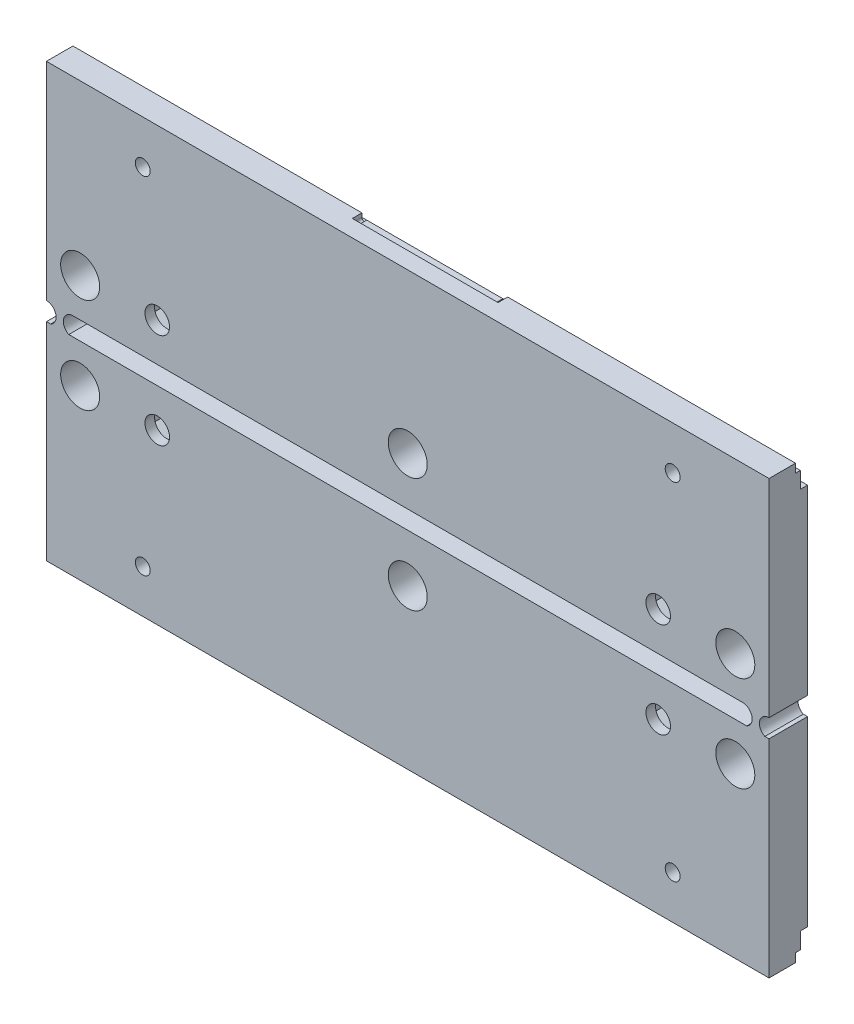
from build123d import *

# Parameters (mm, degrees)
SKETCH_2_W           = 150
SKETCH_2_H           = 43
SKETCH_2_R           = 4.05
EXTRUDE_1_DEPTH      = 8
SKETCH_3_R           = 2.55
CUT_EXTRUDE_1_DEPTH  = 157.246599963
CUT_EXTRUDE_16_DEPTH = 6
CUT_EXTRUDE_2_DEPTH  = 157.246599963
SKETCH_25_R          = 1.55
CUT_EXTRUDE_13_DEPTH = 157.246599963
CUT_EXTRUDE_11_DEPTH = 2
EXTRUDE_2_DEPTH      = 8


with BuildPart() as part:
    # 草图2 → 凸台-拉伸1 (new body)
    with BuildSketch(Plane.XY):
        with Locations((75, 21.5)):
            Rectangle(SKETCH_2_W, SKETCH_2_H)
        with Locations((7, 8)):
            Circle(SKETCH_2_R, mode=Mode.SUBTRACT)
        with Locations((75, 10)):
            Circle(SKETCH_2_R, mode=Mode.SUBTRACT)
        with Locations((143, 8)):
            Circle(SKETCH_2_R, mode=Mode.SUBTRACT)
    extrude_1 = extrude(amount=EXTRUDE_1_DEPTH)

    # 草图3 → 切除-拉伸1 (cut, through all)
    with BuildSketch(Plane.XY.offset(8)):
        with Locations((23, 8)):
            Circle(SKETCH_3_R)
        with Locations((127, 8)):
            Circle(SKETCH_3_R)
    cut_extrude_1 = extrude(amount=-CUT_EXTRUDE_1_DEPTH, mode=Mode.SUBTRACT)

    # 草图28 → 切除-拉伸16 (cut)
    with BuildSketch(Plane(origin=(0, 0, 0), x_dir=(-1, 0, 0), z_dir=(0, 0, -1))):
        Polygon((-122.9, 5.632863896), (-122.9, 10.367136104), (-127, 12.734272207), (-131.1, 10.367136104), (-131.1, 5.632863896), (-127, 3.265727793), align=None)
        Polygon((-18.9, 5.632863896), (-18.9, 10.367136104), (-23, 12.734272207), (-27.1, 10.367136104), (-27.1, 5.632863896), (-23, 3.265727793), align=None)
    cut_extrude_16 = extrude(amount=-CUT_EXTRUDE_16_DEPTH, mode=Mode.SUBTRACT)

    # 草图4 → 切除-拉伸2 (cut, through all)
    with BuildSketch(Plane(origin=(150, 0, 0), x_dir=(0, 0, -1), z_dir=(1, 0, 0))):
        Polygon((-1.5, 41.2), (-2.5, 41.2), (-2.5, 43), (0, 43), (0, 37.8), (-1.5, 37.8), align=None)
    cut_extrude_2 = extrude(amount=-CUT_EXTRUDE_2_DEPTH, mode=Mode.SUBTRACT)

    # 草图25 → 切除-拉伸13 (cut, through all)
    with BuildSketch(Plane(origin=(0, 0, 0), x_dir=(-1, 0, 0), z_dir=(0, 0, -1))):
        with Locations((-130, 34)):
            Circle(SKETCH_25_R)
        with Locations((-20, 34)):
            Circle(SKETCH_25_R)
    cut_extrude_13 = extrude(amount=-CUT_EXTRUDE_13_DEPTH, mode=Mode.SUBTRACT)

    # 草图19 → 切除-拉伸11 (cut)
    with BuildSketch(Plane(origin=(0, 0, 2.5), x_dir=(-1, 0, 0), z_dir=(0, 0, -1))):
        with BuildLine():
            Line((-60, 43), (-90.247938178, 43))
            Line((-90.247938178, 43), (-90.247938178, 42.2))
            ThreePointArc((-90.247938178, 42.2), (-89.747938178, 41.7), (-89.247938178, 42.2))
            Line((-89.247938178, 42.2), (-61, 42.2))
            ThreePointArc((-61, 42.2), (-60.5, 41.7), (-60, 42.2))
            Line((-60, 42.2), (-60, 43))
        make_face()
    cut_extrude_11 = extrude(amount=-CUT_EXTRUDE_11_DEPTH, mode=Mode.SUBTRACT)

    # 草图22 → 凸台-拉伸2 (add)
    with BuildSketch(Plane.XY.offset(8)):
        with BuildLine():
            Line((0, -4), (5.5, -4))
            ThreePointArc((5.5, -4), (3.5, -2), (5.5, 0))
            Line((5.5, 0), (0, 0))
            ThreePointArc((0, 0), (2, -2), (0, -4))
        make_face()
        with BuildLine():
            Line((150, 0), (144.5, 0))
            ThreePointArc((144.5, 0), (146.5, -2), (144.5, -4))
            Line((144.5, -4), (150, -4))
            ThreePointArc((150, -4), (148, -2), (150, 0))
        make_face()
    extrude(amount=-EXTRUDE_2_DEPTH)

    # 镜向2: 凸台-拉伸1, 切除-拉伸1, 切除-拉伸16, 切除-拉伸2, 切除-拉伸13, 切除-拉伸11 across plane
    add(extrude_1.mirror(Plane(origin=(0, -1.9, 0), x_dir=(0, 0, 1), z_dir=(0, -1, 0))))
    add(cut_extrude_1.mirror(Plane(origin=(0, -1.9, 0), x_dir=(0, 0, 1), z_dir=(0, -1, 0))), mode=Mode.SUBTRACT)
    add(cut_extrude_16.mirror(Plane(origin=(0, -1.9, 0), x_dir=(0, 0, 1), z_dir=(0, -1, 0))), mode=Mode.SUBTRACT)
    add(cut_extrude_2.mirror(Plane(origin=(0, -1.9, 0), x_dir=(0, 0, 1), z_dir=(0, -1, 0))), mode=Mode.SUBTRACT)
    add(cut_extrude_13.mirror(Plane(origin=(0, -1.9, 0), x_dir=(0, 0, 1), z_dir=(0, -1, 0))), mode=Mode.SUBTRACT)
    add(cut_extrude_11.mirror(Plane(origin=(0, -1.9, 0), x_dir=(0, 0, 1), z_dir=(0, -1, 0))), mode=Mode.SUBTRACT)


solid = part.part
